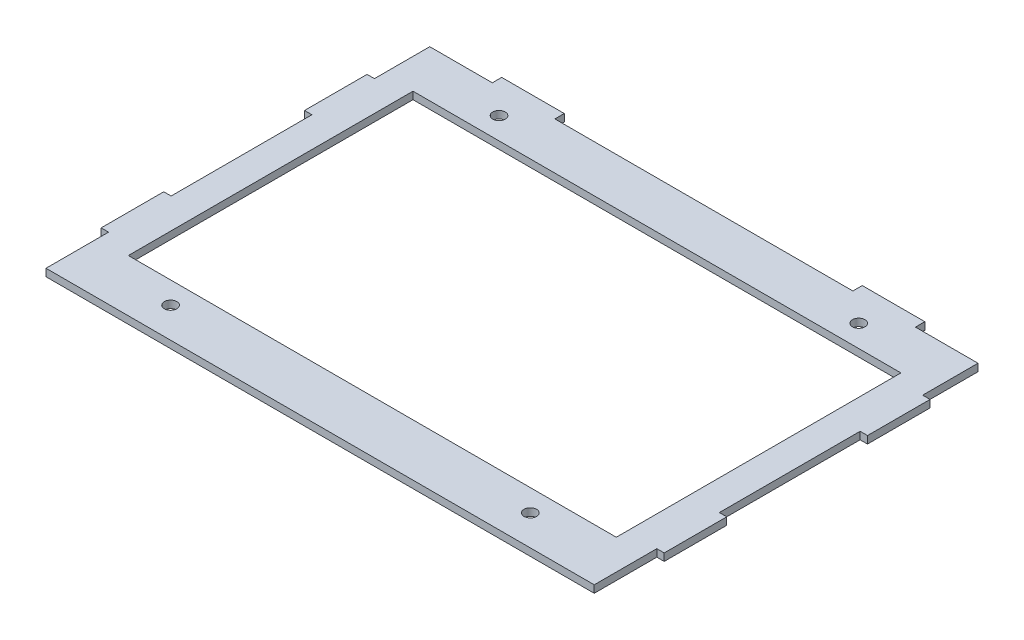
from build123d import *

# Parameters (mm, degrees)
BOSS_EXTRUDE1_DEPTH = 2.3622
SKETCH2_R           = 2
SKETCH2_W           = 156
SKETCH2_H           = 91
CUT_EXTRUDE1_DEPTH  = 119.672908335


with BuildPart() as part:
    # Sketch1 → Boss-Extrude1 (new body)
    with BuildSketch(Plane(origin=(0, 0, 0), x_dir=(1, 0, 0), z_dir=(0, 1, 0))):
        Polygon((-93.522777066, 66.883834733), (-73.522777066, 66.883834733), (-73.522777066, 69.883834733), (-53.522777066, 69.883834733), (-53.522777066, 66.883834733), (41.752822934, 66.883834733), (41.752822934, 69.883834733), (61.752822934, 69.883834733), (61.752822934, 66.883834733), (81.752822934, 66.883834733), (81.752822934, 49.193834733), (84.115022934, 49.193834733), (84.115022934, 29.193834733), (81.752822934, 29.193834733), (81.752822934, -15.806165267), (84.115022934, -15.806165267), (84.115022934, -35.806165267), (81.752822934, -35.806165267), (81.752822934, -55.806165267), (-93.522777066, -55.806165267), (-93.522777066, -35.806165267), (-95.884977066, -35.806165267), (-95.884977066, -15.806165267), (-93.522777066, -15.806165267), (-93.522777066, 29.193834733), (-95.884977066, 29.193834733), (-95.884977066, 49.193834733), (-93.522777066, 49.193834733), align=None)
    extrude(amount=BOSS_EXTRUDE1_DEPTH)

    # Sketch2 → Cut-Extrude1 (cut, through all)
    with BuildSketch(Plane(origin=(0, 2.3622, 0), x_dir=(1, 0, 0), z_dir=(0, 1, 0))):
        with Locations(Location((-63.384977066, 58.883834733, 0), (0, 0, 270))):
            Circle(SKETCH2_R)
        with Locations(Location((51.615022934, 58.883834733, 0), (0, 0, 270))):
            Circle(SKETCH2_R)
        with Locations(Location((-63.384977066, -46.116165267, 0), (0, 0, 270))):
            Circle(SKETCH2_R)
        with Locations(Location((51.615022934, -46.116165267, 0), (0, 0, 270))):
            Circle(SKETCH2_R)
        with Locations((-5.884977066, 6.383834733)):
            Rectangle(SKETCH2_W, SKETCH2_H)
    extrude(amount=-CUT_EXTRUDE1_DEPTH, mode=Mode.SUBTRACT)


solid = part.part
